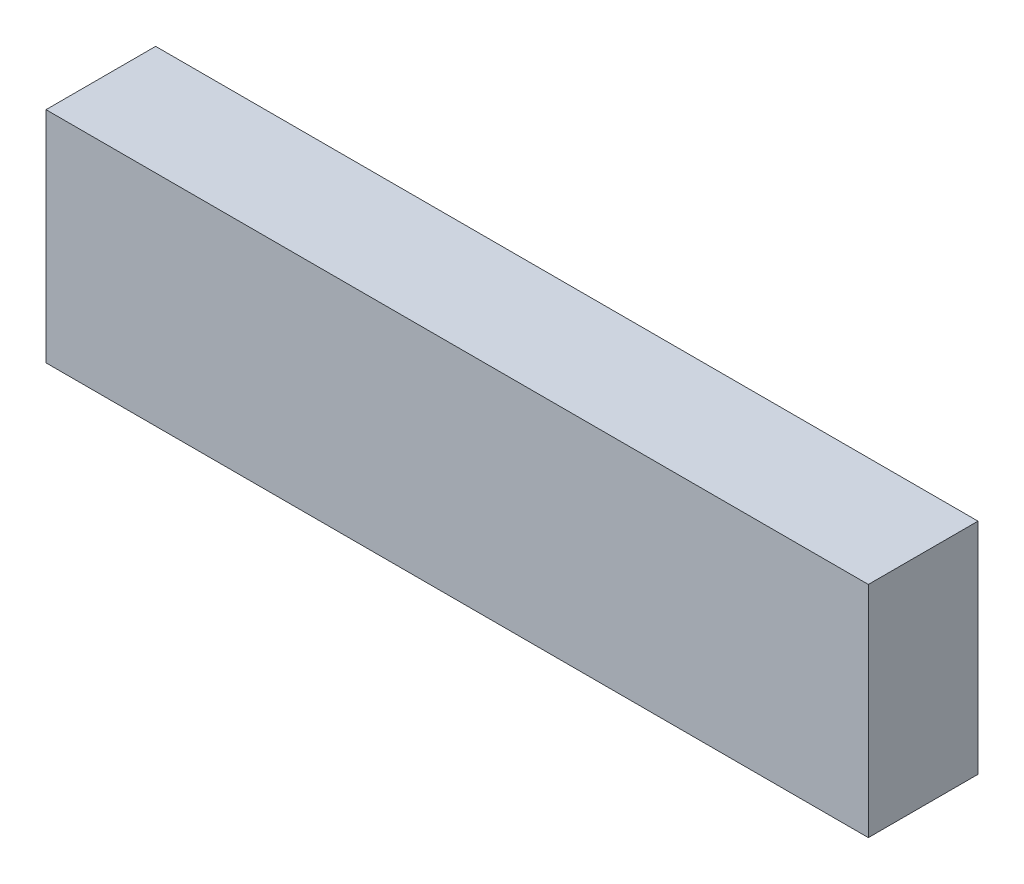
from build123d import *

# Parameters (mm, degrees)
SKETCH5_W           = 30
SKETCH5_H           = 4
BOSS_EXTRUDE4_DEPTH = 8


with BuildPart() as part:
    # Sketch5 → Boss-Extrude4 (new body)
    with BuildSketch(Plane(origin=(0, 1, 0), x_dir=(1, 0, 0), z_dir=(0, 1, 0))):
        Rectangle(SKETCH5_W, SKETCH5_H)
    extrude(amount=BOSS_EXTRUDE4_DEPTH)


solid = part.part
